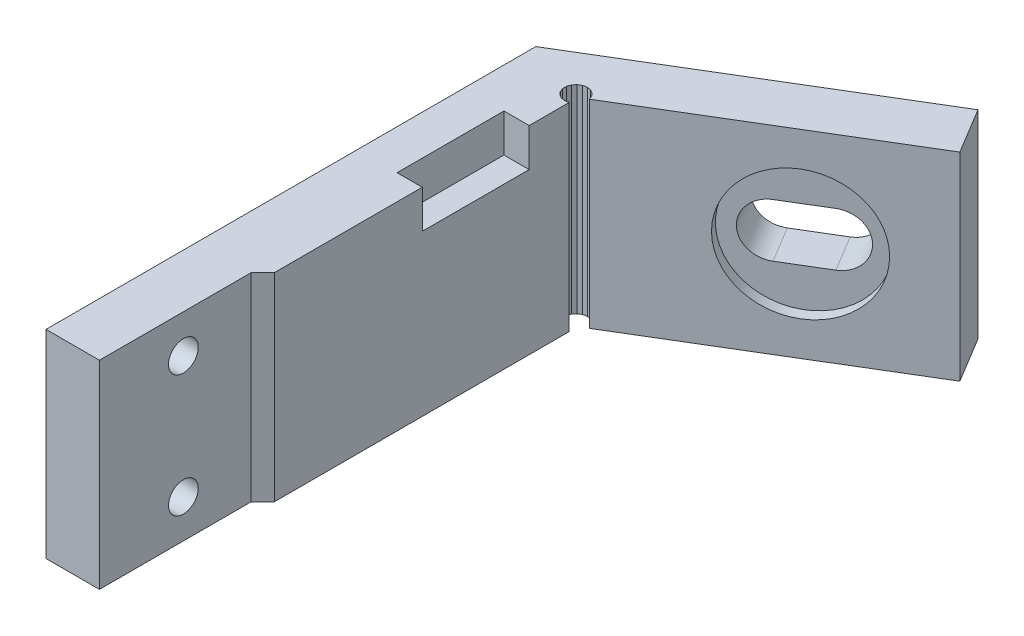
from build123d import *

# Parameters (mm, degrees)
LEG_AND_PAD_DEPTH          = 13
SCREW_HEAD_RELIEF_SKETCH_W = 14
SCREW_HEAD_RELIEF_SKETCH_H = 6
SCREW_HEAD_RELIEF_DEPTH    = 2.35
M6_SLOT_MIDDLE_DEPTH       = 3.5
SCREW_HOLES_SKETCH_R       = 1.95
SCREW_HOLES_DEPTH          = 4.5


with BuildPart() as part:
    # leg and pad sketch → leg and pad (new, symmetric)
    with BuildSketch(Plane(origin=(0, -20.7, 0), x_dir=(1, 0, 0), z_dir=(0, 1, 0))):
        Polygon((0.551289683, 30.332713936), (0.367250577, 30.819395741), (0.028023026, 31.213926146), (-0.425575667, 31.468833575), (-0.938966578, 31.553446481), (-1.450376329, 31.457583879), (-1.898269923, 31.192780366), (-2.228754897, 30.790898227), (-2.402065893, 30.30029363), (-2.397349395, 29.779998208), (-2.215172912, 29.292616119), (-1.877456693, 28.896791249), (-1.424836191, 28.640150931), (-0.91177263, 28.55357522), (-0.4, 28.647481273), (-0.4, -9.98), (-1.92, -11.5), (-1.92, -31.37), (-8.92, -31.37), (-8.92, 32.792642706), (27.204821487, 54.594667874), (30.821788068, 48.601542416), align=None)
    extrude(amount=LEG_AND_PAD_DEPTH, both=True)

    # screw head relief sketch → screw head relief (cut, symmetric)
    with BuildSketch(Plane(origin=(-1.35, 0, 0), x_dir=(0, 0, -1), z_dir=(1, 0, 0))):
        with Locations((16.4, -9.7)):
            Rectangle(SCREW_HEAD_RELIEF_SKETCH_W, SCREW_HEAD_RELIEF_SKETCH_H)
    extrude(amount=SCREW_HEAD_RELIEF_DEPTH, both=True, mode=Mode.SUBTRACT)

    # insert flange relief sketch → insert flange relief (revolve, cut)
    with BuildSketch(Plane(origin=(0, -20.7, 0), x_dir=(1, 0, 0), z_dir=(0, 1, 0)), mode=Mode.PRIVATE) as insert_flange_relief_sk:
        Polygon((18.324853729, 39.891397061), (17.03307995, 42.03179901), (9.755713323, 37.639768162), (11.047487102, 35.499366213), align=None)
    revolve(insert_flange_relief_sk.sketch.rotate(Axis((18.324853729, -20.7, -39.891397061), (-0.5167095115681243, 0, -0.8561607796757748)), 180), axis=Axis((18.324853729, -20.7, -39.891397061), (-0.5167095115681243, 0, -0.8561607796757748)), mode=Mode.SUBTRACT)

    # M6 slot end 1 sketch → M6 slot end 1 (revolve, cut)
    with BuildSketch(Plane(origin=(0, -20.7, 0), x_dir=(1, 0, 0), z_dir=(0, 1, 0)), mode=Mode.PRIVATE) as m6_slot_end_1_sk:
        Polygon((20.893336068, 41.441525596), (16.242950464, 49.146972613), (13.246387735, 47.338489322), (17.896773339, 39.633042305), align=None)
    revolve(m6_slot_end_1_sk.sketch.rotate(Axis((20.893336068, -20.7, -41.441525596), (-0.5167095115681233, 0, -0.8561607796757753)), 180), axis=Axis((20.893336068, -20.7, -41.441525596), (-0.5167095115681233, 0, -0.8561607796757753)), mode=Mode.SUBTRACT)

    # M6 slot end 2 sketch → M6 slot end 2 (revolve, cut)
    with BuildSketch(Plane(origin=(0, -20.7, 0), x_dir=(1, 0, 0), z_dir=(0, 1, 0))):
        Polygon((15.75637139, 38.341268526), (11.105985786, 46.046715543), (8.109423057, 44.238232253), (12.759808661, 36.532785236), align=None)
    revolve(axis=Axis((15.75637139, -20.7, -38.341268526), (-0.5167095115681234, 0, -0.8561607796757752)), mode=Mode.SUBTRACT)

    # M6 slot middle sketch → M6 slot middle (cut, symmetric)
    with BuildSketch(Plane(origin=(0, -20.7, 0), x_dir=(1, 0, 0), z_dir=(0, 1, 0))):
        Polygon((15.75637139, 38.341268526), (20.893336068, 41.441525596), (16.242950464, 49.146972613), (11.105985786, 46.046715543), align=None)
    extrude(amount=M6_SLOT_MIDDLE_DEPTH, both=True, mode=Mode.SUBTRACT)

    # screw holes sketch → screw holes (cut, symmetric)
    with BuildSketch(Plane(origin=(-5.42, 0, 0), x_dir=(0, 0, -1), z_dir=(1, 0, 0))):
        with Locations((-20.375, -28.7)):
            Circle(SCREW_HOLES_SKETCH_R)
        with Locations((-20.375, -12.7)):
            Circle(SCREW_HOLES_SKETCH_R)
    extrude(amount=SCREW_HOLES_DEPTH, both=True, mode=Mode.SUBTRACT)


solid = part.part
